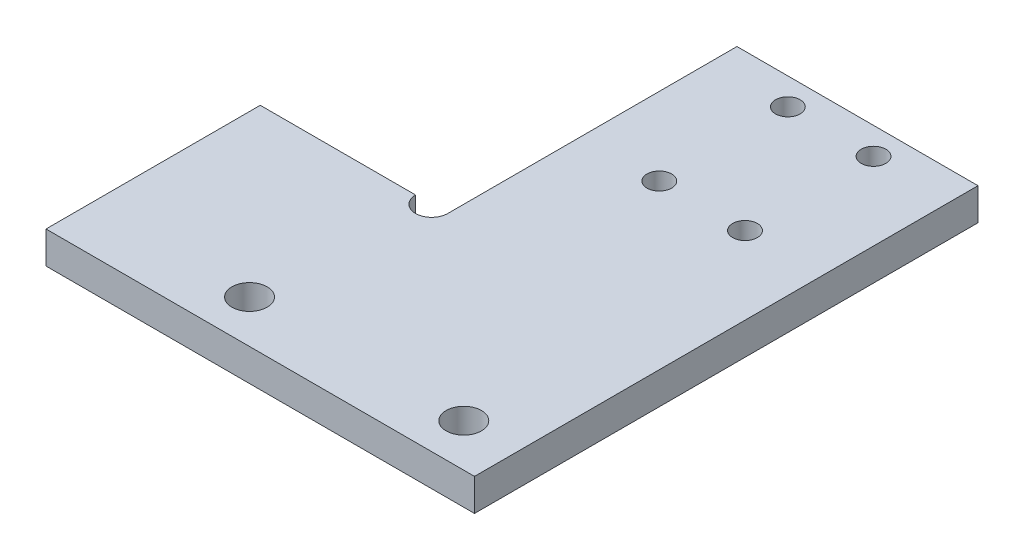
from build123d import *

# Parameters (mm, degrees)
SKETCH_1_W      = 22.5
SKETCH_1_H      = 17
EXTRUDE_1_DEPTH = 3
HOLE_WIZARD_1_D = 2.3
SKETCH_5_W      = 22.5
SKETCH_5_H      = 30
EXTRUDE_2_DEPTH = 3
SKETCH_6_W      = 17.5
SKETCH_6_H      = 20
EXTRUDE_3_DEPTH = 3
HOLE_WIZARD_2_D = 3.3
HOLE_WIZARD_3_D = 3


with BuildPart() as part:
    # 草图1 → 凸台-拉伸1 (new body)
    with BuildSketch(Plane(origin=(0, 0, 0), x_dir=(1, 0, 0), z_dir=(0, 1, 0))):
        Rectangle(SKETCH_1_W, SKETCH_1_H)
    extrude(amount=EXTRUDE_1_DEPTH)

    # 孔1 (through all)
    with Locations(Plane(origin=(0, 3, 0), x_dir=(1, 0, 0), z_dir=(0, 1, 0))):
        with Locations((-4, 6), (4, 6), (-4, -6), (4, -6)):
            Hole(HOLE_WIZARD_1_D / 2)

    # 草图5 → 凸台-拉伸2 (add)
    with BuildSketch(Plane(origin=(0, 3, 0), x_dir=(1, 0, 0), z_dir=(0, 1, 0))):
        with Locations((0, -23.5)):
            Rectangle(SKETCH_5_W, SKETCH_5_H)
    extrude(amount=-EXTRUDE_2_DEPTH)

    # 草图6 → 凸台-拉伸3 (add)
    with BuildSketch(Plane(origin=(0, 3, 0), x_dir=(1, 0, 0), z_dir=(0, 1, 0))):
        with Locations((-20, -28.5)):
            Rectangle(SKETCH_6_W, SKETCH_6_H)
    extrude(amount=-EXTRUDE_3_DEPTH)

    # 孔2 (through all)
    with Locations(Plane(origin=(0, 3, 0), x_dir=(1, 0, 0), z_dir=(0, 1, 0))):
        with Locations((6.25, -34.5), (6.25, -54.5), (-13.75, -54.5), (-13.75, -34.5)):
            Hole(HOLE_WIZARD_2_D / 2)

    # 孔3 (through all)
    with Locations(Plane(origin=(0, 3, 0), x_dir=(1, 0, 0), z_dir=(0, 1, 0))):
        with Locations((-12.75, -18.5)):
            Hole(HOLE_WIZARD_3_D / 2)


solid = part.part
